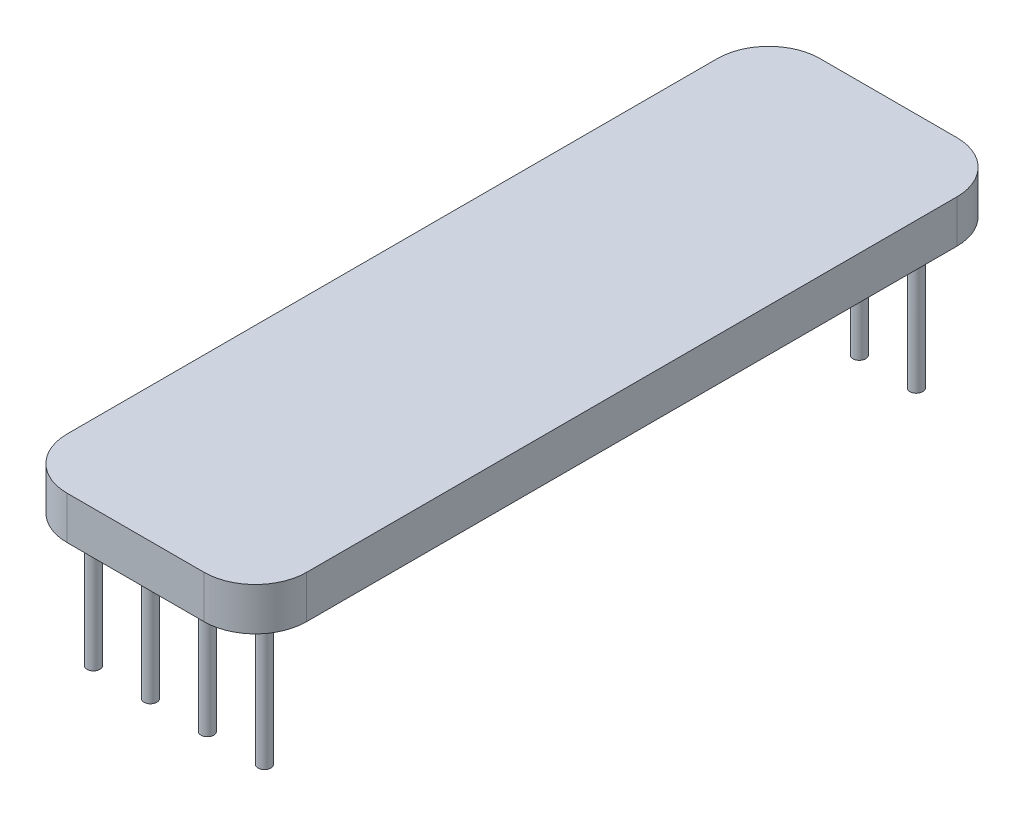
from build123d import *

# Parameters (mm, degrees)
BOSS_EXTRUDE1_DEPTH = 2.5
SKETCH4_R           = 0.375
BOSS_EXTRUDE3_DEPTH = 8
LPATTERN1_COUNT     = 2
LPATTERN1_PITCH     = 38.1


with BuildPart() as part:
    # Sketch2 → Boss-Extrude1 (new body)
    with BuildSketch(Plane(origin=(0, 0, 0), x_dir=(1, 0, 0), z_dir=(0, 1, 0))):
        with BuildLine():
            Line((-4, 22), (4, 22))
            ThreePointArc((4, 22), (6.121320344, 21.121320344), (7, 19))
            Line((7, 19), (7, -19))
            ThreePointArc((7, -19), (6.121320344, -21.121320344), (4, -22))
            Line((4, -22), (-4, -22))
            ThreePointArc((-4, -22), (-6.121320344, -21.121320344), (-7, -19))
            Line((-7, -19), (-7, 19))
            ThreePointArc((-7, 19), (-6.121320344, 21.121320344), (-4, 22))
        make_face()
    extrude(amount=BOSS_EXTRUDE1_DEPTH)

    # Sketch4 → Boss-Extrude3 (add)
    with BuildSketch(Plane.XZ):
        with Locations(Location((-5, 19.46, 0), (0, 0, 90))):
            Circle(SKETCH4_R)
        with Locations(Location((-1.67, 19.46, 0), (0, 0, 90))):
            Circle(SKETCH4_R)
        with Locations(Location((1.66, 19.46, 0), (0, 0, 90))):
            Circle(SKETCH4_R)
        with Locations(Location((4.99, 19.46, 0), (0, 0, 90))):
            Circle(SKETCH4_R)
    boss_extrude3 = extrude(amount=BOSS_EXTRUDE3_DEPTH)

    # LPattern1: Boss-Extrude3 ×2
    with Locations(*[(0, 0, -i * LPATTERN1_PITCH) for i in range(1, LPATTERN1_COUNT)]):
        add(boss_extrude3)


solid = part.part
